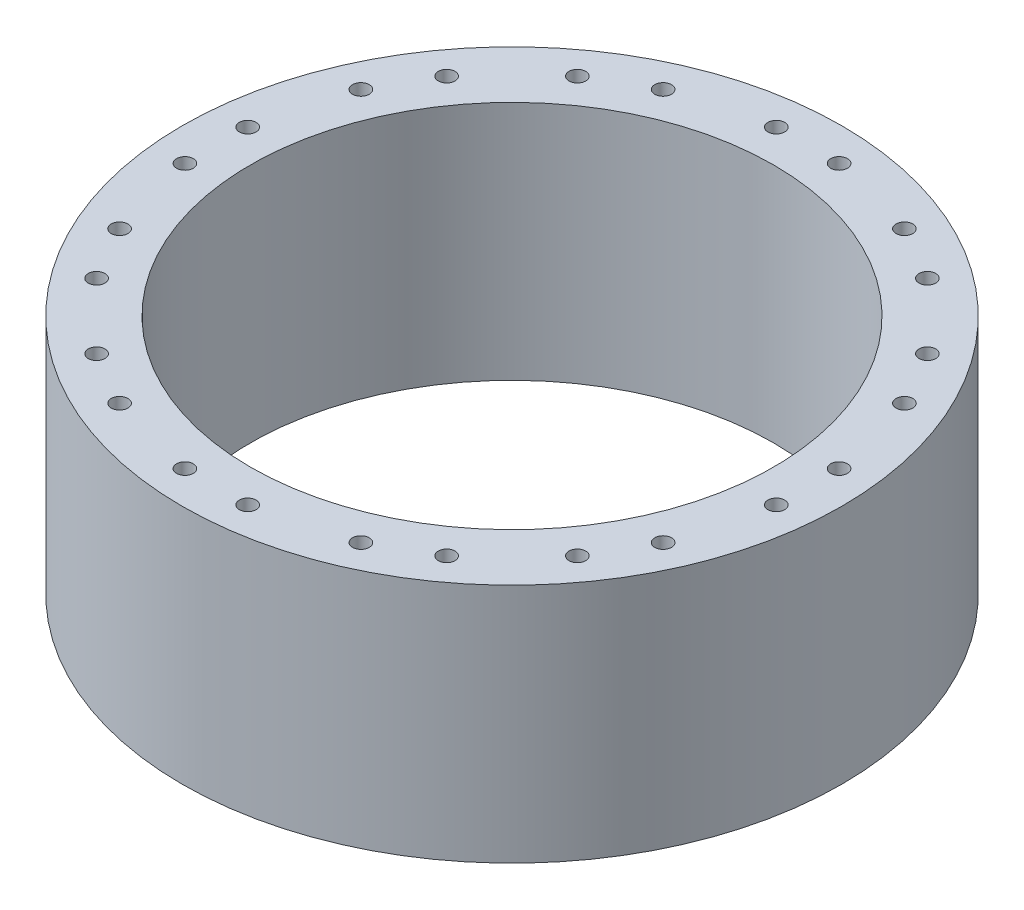
from build123d import *

# Parameters (mm, degrees)
BOSS_EXTRUDE1_DEPTH      = 105
BOSS_EXTRUDE1_DEPTH_BACK = 10
SKETCH1_R                = 157.5
SKETCH1_R_2              = 125
SKETCH3_R                = 4
CUT_EXTRUDE2_DEPTH       = 251.674091202
CIRPATTERN2_COUNT        = 12


with BuildPart() as part:
    # Sketch1 → Boss-Extrude1 (new, two sides: drawn at the far end of the back side and taken through both)
    with BuildSketch(Plane(origin=(0, 0, 0), x_dir=(1, 0, 0), z_dir=(0, 1, 0)).offset(-BOSS_EXTRUDE1_DEPTH_BACK)):
        with Locations(Location((0, 0, 0), (0, 0, 270))):
            Circle(SKETCH1_R)
        with Locations(Location((0, 0, 0), (0, 0, 270))):
            Circle(SKETCH1_R_2, mode=Mode.SUBTRACT)
    extrude(amount=BOSS_EXTRUDE1_DEPTH + BOSS_EXTRUDE1_DEPTH_BACK)

    # Sketch3 → Cut-Extrude2 (cut, through all)
    with BuildSketch(Plane(origin=(0, -10, 0), x_dir=(-1, 0, 0), z_dir=(0, -1, 0))):
        with Locations(Location((-15, 141.25, 0), (0, 0, 90))):
            Circle(SKETCH3_R)
        with Locations(Location((15, 141.25, 0), (0, 0, 270))):
            Circle(SKETCH3_R)
    cut_extrude2 = extrude(amount=-CUT_EXTRUDE2_DEPTH, mode=Mode.SUBTRACT)

    # CirPattern2: Cut-Extrude2 ×12 about axis
    cirpattern2_axis = Axis((0, 0, 0), (0, 1, 0))
    for i in range(1, CIRPATTERN2_COUNT):
        add(cut_extrude2.rotate(cirpattern2_axis, i * 360 / CIRPATTERN2_COUNT), mode=Mode.SUBTRACT)


solid = part.part
